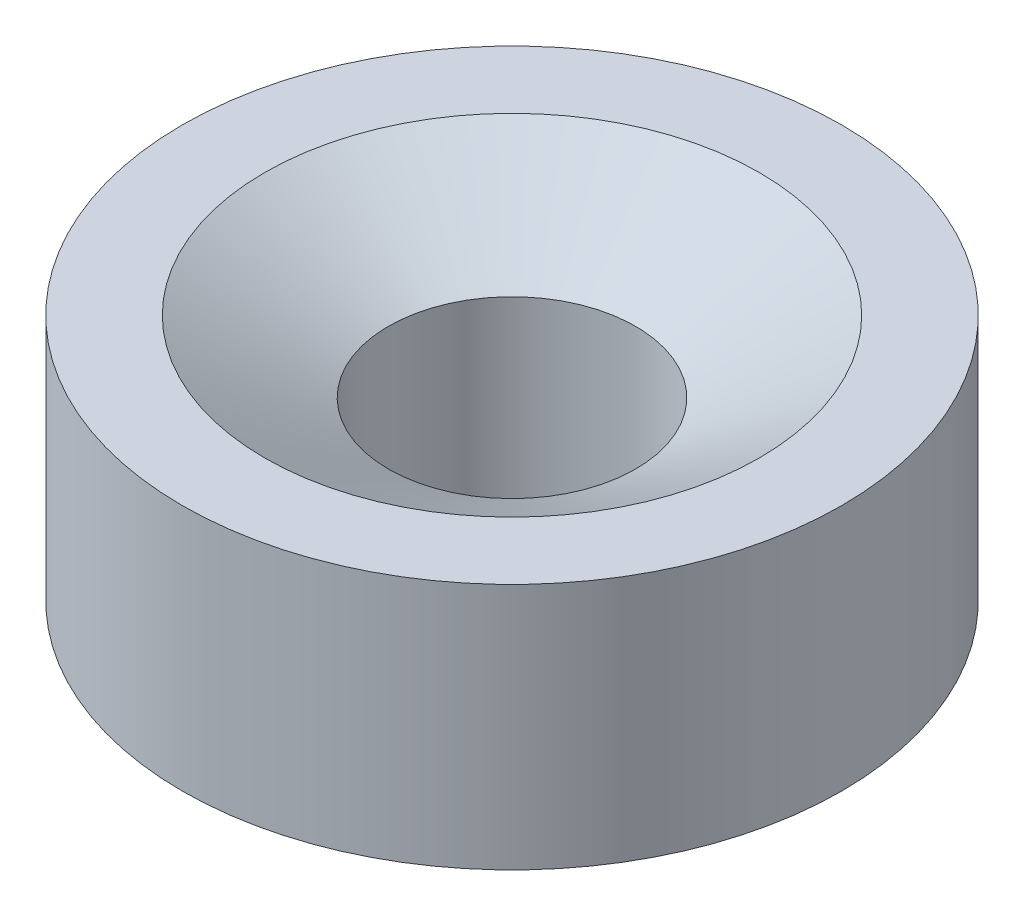
from build123d import *

# Parameters (mm, degrees)
SKETCH1_R           = 4
SKETCH1_R_2         = 1.5
BOSS_EXTRUDE1_DEPTH = 3
CHAMFER1_SIZE       = 1.5
CHAMFER1_SIZE2      = 0.866025404


with BuildPart() as part:
    # Sketch1 → Boss-Extrude1 (new body)
    with BuildSketch(Plane(origin=(0, 0, 0), x_dir=(1, 0, 0), z_dir=(0, 1, 0))):
        with Locations(Location((0, 0, 0), (0, 0, 270))):
            Circle(SKETCH1_R)
        with Locations(Location((0, 0, 0), (0, 0, 270))):
            Circle(SKETCH1_R_2, mode=Mode.SUBTRACT)
    extrude(amount=BOSS_EXTRUDE1_DEPTH)

    # Chamfer1
    chamfer1_edges = [part.edges().sort_by_distance(p)[0] for p in [
        (0, 3, -1.5),
    ]]
    chamfer1_side = [part.faces().sort_by_distance(p)[0] for p in [
        (0, 3, -3.886862915),
    ]]
    chamfer(chamfer1_edges, length=CHAMFER1_SIZE, length2=CHAMFER1_SIZE2, reference=chamfer1_side[0])


solid = part.part
